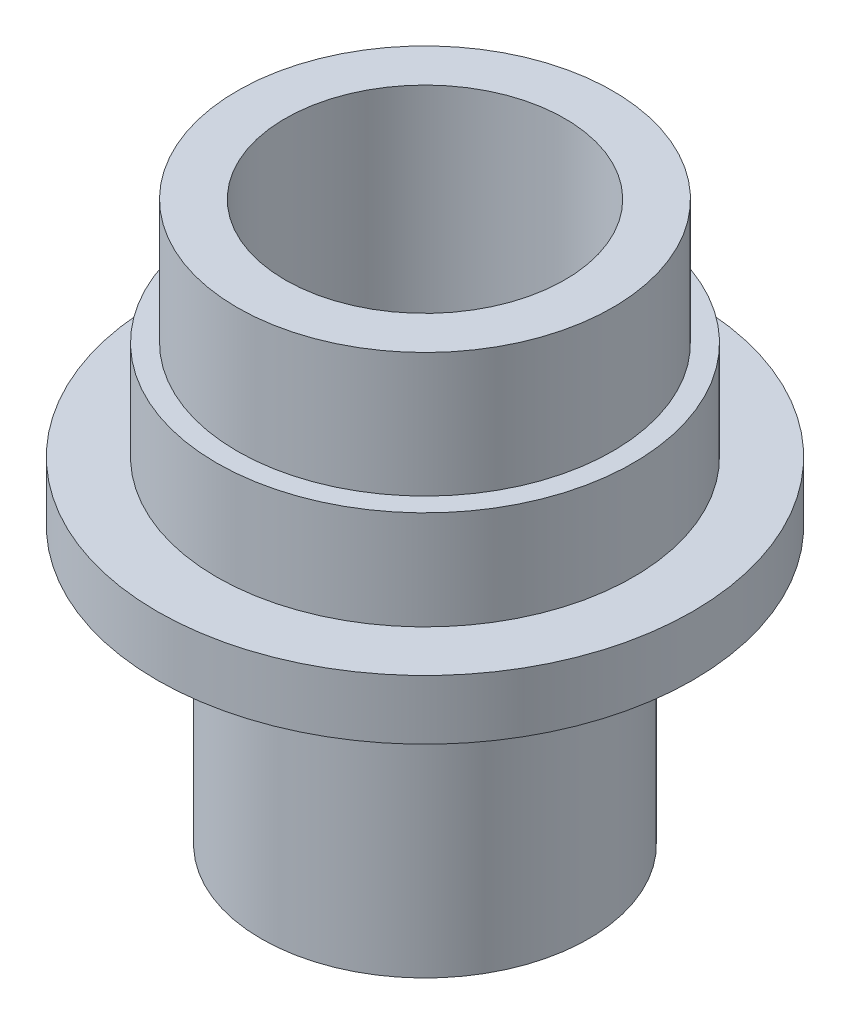
from build123d import *


with BuildPart() as part:
    # Croquis1 → Revolución1 (revolve)
    with BuildSketch(Plane.XY, mode=Mode.PRIVATE) as revoluci_n1_sk:
        Polygon((0, 0), (-4.7, 0), (-4.7, 9), (-6.31, 9), (-6.31, 4.82), (-7, 4.82), (-7, 1.5), (-9, 1.5), (-9, -0.5), (-7, -0.5), (-7, -1), (-5.5, -1), (-5.5, -9.78), (0, -9.78), align=None)
    revolve(revoluci_n1_sk.sketch.rotate(Axis((0, 46.584923077, 0), (0, -1, 0)), 270), axis=Axis((0, 46.584923077, 0), (0, -1, 0)))


solid = part.part
